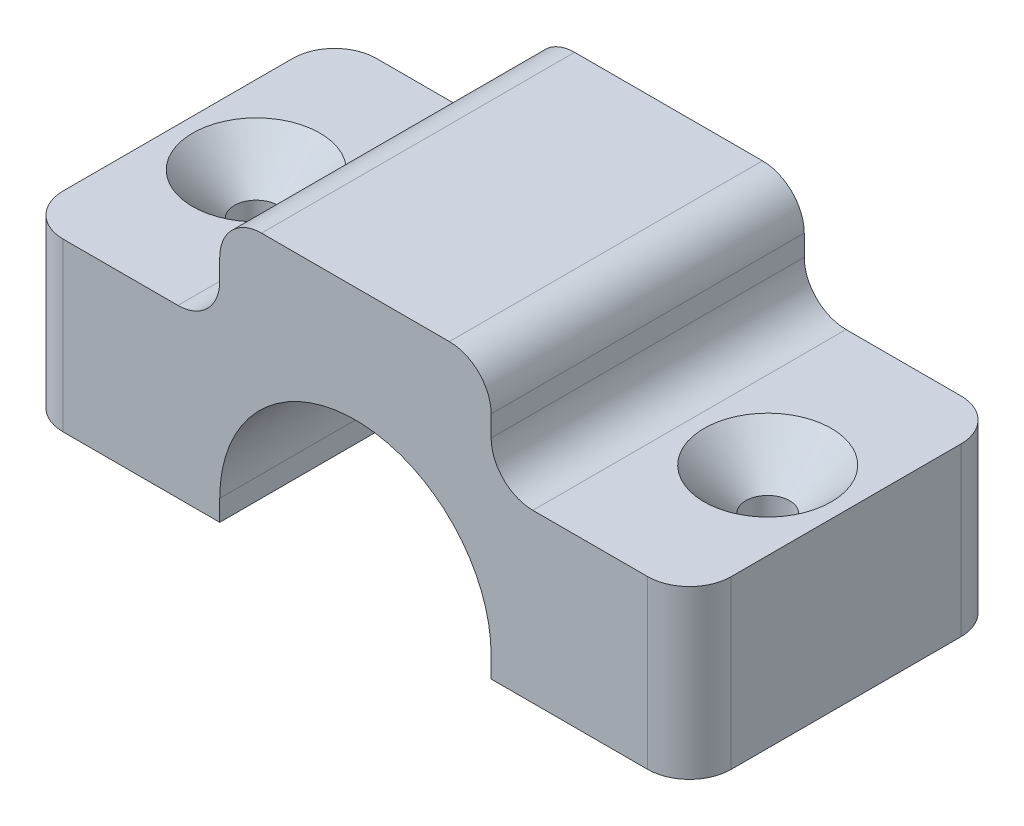
from build123d import *

# Parameters (mm, degrees)
BOSS_EXTRUDE1_DEPTH     = 15
CUT_EXTRUDE1_DEPTH      = 19
CUT_EXTRUDE1_DEPTH_BACK = 26
CUT_EXTRUDE1_START      = -12
SKETCH2_R               = 1.05
FILLET1_R               = 2
SKETCH3_R               = 1.05
BOSS_EXTRUDE2_DEPTH     = 1
CUT_EXTRUDE2_START      = -12
SKETCH2_3_W             = 9.5
SKETCH2_3_H             = 15
SKETCH2_3_R             = 1.05
CUT_EXTRUDE2_DEPTH      = 5
FILLET2_R               = 2
CHAMFER1_SIZE           = 2


with BuildPart() as part:
    # Sketch1 → Boss-Extrude1 (new body)
    with BuildSketch(Plane.XY):
        with BuildLine():
            Line((-16, 12), (-16, 0))
            Line((-16, 0), (-6.5, 0))
            ThreePointArc((-6.5, 0), (0, 6.5), (6.5, 0))
            Line((6.5, 0), (16, 0))
            Line((16, 0), (16, 12))
            Line((16, 12), (-16, 12))
        make_face()
    extrude(amount=BOSS_EXTRUDE1_DEPTH)

    # Sketch2 → Cut-Extrude1 (cut, two sides: drawn at the far end of the back side and taken through both)
    with BuildSketch(Plane.XZ.offset(CUT_EXTRUDE1_START - CUT_EXTRUDE1_DEPTH_BACK)):
        with Locations((-12.25, 7.5)):
            Circle(SKETCH2_R)
        with Locations((12.25, 7.5)):
            Circle(SKETCH2_R)
    extrude(amount=CUT_EXTRUDE1_DEPTH + CUT_EXTRUDE1_DEPTH_BACK, mode=Mode.SUBTRACT)

    # Fillet1
    fillet1_edges = [part.edges().sort_by_distance(p)[0] for p in [
        (16, 6, 15),
        (-16, 6, 15),
        (-16, 6, 0),
        (16, 6, 0),
    ]]
    fillet(fillet1_edges, radius=FILLET1_R)

    # Sketch3 → Boss-Extrude2 (add)
    # profile 1 of 2: a face of its own
    with BuildSketch(Plane.XZ):
        with BuildLine():
            Line((-14, 0), (-6.5, 0))
            Line((-6.5, 0), (-6.5, 15))
            Line((-6.5, 15), (-14, 15))
            ThreePointArc((-14, 15), (-15.414213562, 14.414213562), (-16, 13))
            Line((-16, 13), (-16, 2))
            ThreePointArc((-16, 2), (-15.414213562, 0.585786438), (-14, 0))
        make_face()
        with Locations((-12.25, 7.5)):
            Circle(SKETCH3_R, mode=Mode.SUBTRACT)
    # profile 2 of 2: a face of its own
    with BuildSketch(Plane.XZ):
        with BuildLine():
            Line((6.5, 0), (14, 0))
            ThreePointArc((14, 0), (15.414213562, 0.585786438), (16, 2))
            Line((16, 2), (16, 13))
            ThreePointArc((16, 13), (15.414213562, 14.414213562), (14, 15))
            Line((14, 15), (6.5, 15))
            Line((6.5, 15), (6.5, 0))
        make_face()
        with Locations((12.25, 7.5)):
            Circle(SKETCH3_R, mode=Mode.SUBTRACT)
    extrude(amount=BOSS_EXTRUDE2_DEPTH)

    # Sketch2<3> → Cut-Extrude2 (cut)
    # profile 1 of 2: a face of its own
    with BuildSketch(Plane.XZ.offset(CUT_EXTRUDE2_START)):
        with Locations((-11.25, 7.5)):
            Rectangle(SKETCH2_3_W, SKETCH2_3_H)
        with Locations((-12.25, 7.5)):
            Circle(SKETCH2_3_R, mode=Mode.SUBTRACT)
    # profile 2 of 2: a face of its own
    with BuildSketch(Plane.XZ.offset(CUT_EXTRUDE2_START)):
        with Locations((11.25, 7.5)):
            Rectangle(SKETCH2_3_W, SKETCH2_3_H)
        with Locations((12.25, 7.5)):
            Circle(SKETCH2_3_R, mode=Mode.SUBTRACT)
    extrude(amount=CUT_EXTRUDE2_DEPTH, mode=Mode.SUBTRACT)

    # Fillet2
    fillet2_edges = [part.edges().sort_by_distance(p)[0] for p in [
        (-6.5, 7, 7.5),
        (-6.5, 12, 7.5),
        (6.5, 7, 7.5),
        (6.5, 12, 7.5),
    ]]
    fillet(fillet2_edges, radius=FILLET2_R)

    # Chamfer1
    chamfer1_edges = [part.edges().sort_by_distance(p)[0] for p in [
        (-13.3, 7, 7.5),
        (11.2, 7, 7.5),
    ]]
    chamfer(chamfer1_edges, length=CHAMFER1_SIZE)


solid = part.part
